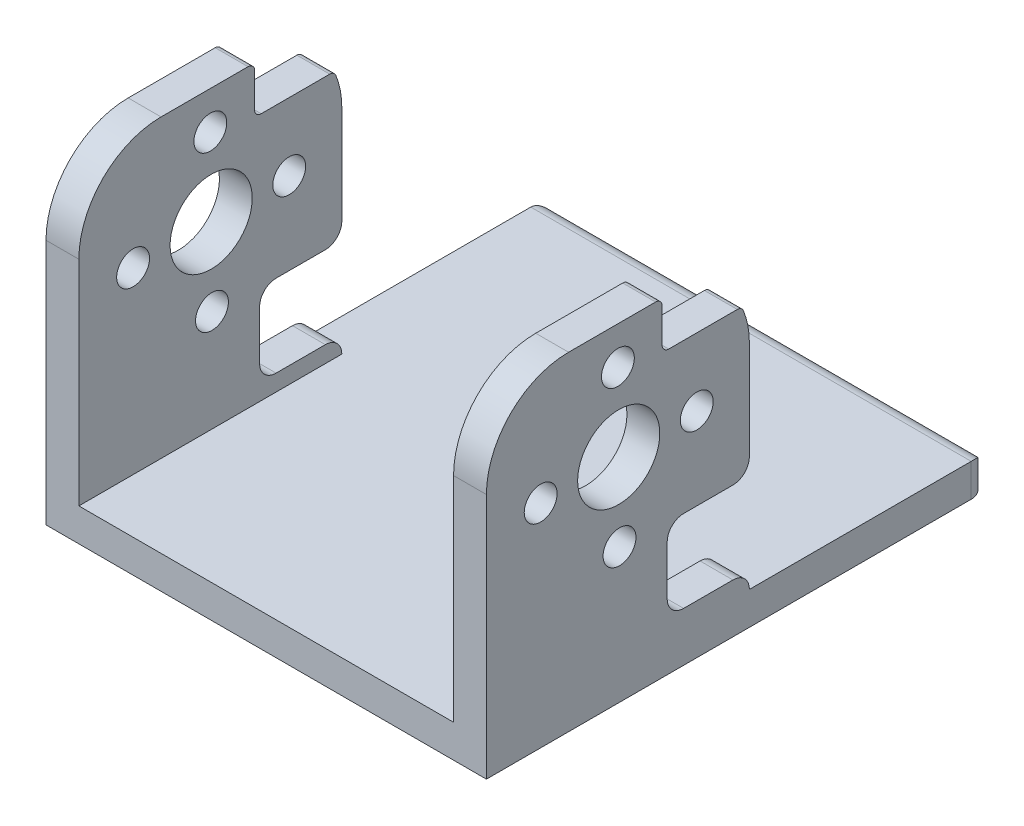
from build123d import *

# Parameters (mm, degrees)
SKETCH1_W           = 34.036
SKETCH1_H           = 20.32
BOSS_EXTRUDE1_DEPTH = 25.4
SKETCH2_W           = 28.956
SKETCH2_H           = 20.32
CUT_EXTRUDE1_DEPTH  = 22.86
SKETCH3_R           = 1.27
SKETCH3_R_2         = 3.175
CUT_EXTRUDE2_DEPTH  = 44.667320687
FILLET2_R           = 6.35
SKETCH8_W           = 6.35
SKETCH8_H           = 6.35
CUT_EXTRUDE5_DEPTH  = 44.667320687
FILLET4_R           = 1.27
SKETCH10_W          = 8.835648684
SKETCH10_H          = 6.964146722
CUT_EXTRUDE6_DEPTH  = 44.667320687
FILLET6_R           = 0.508
FILLET7_R           = 0.508
SKETCH11_W          = 34.036
SKETCH11_H          = 2.54
BOSS_EXTRUDE3_DEPTH = 18.415
FILLET8_R           = 1.27


with BuildPart() as part:
    # Sketch1 → Boss-Extrude1 (new body)
    with BuildSketch(Plane(origin=(0, 0, 0), x_dir=(1, 0, 0), z_dir=(0, 1, 0))):
        Rectangle(SKETCH1_W, SKETCH1_H)
    extrude(amount=BOSS_EXTRUDE1_DEPTH)

    # Sketch2 → Cut-Extrude1 (cut)
    with BuildSketch(Plane(origin=(0, 25.4, 0), x_dir=(1, 0, 0), z_dir=(0, 1, 0))):
        Rectangle(SKETCH2_W, SKETCH2_H)
    extrude(amount=-CUT_EXTRUDE1_DEPTH, mode=Mode.SUBTRACT)

    # Sketch3 → Cut-Extrude2 (cut, through all)
    with BuildSketch(Plane.ZY.offset(17.018)):
        with Locations((0, 22.479)):
            Circle(SKETCH3_R)
        with Locations((-6.096, 16.51)):
            Circle(SKETCH3_R)
        with Locations((-0.127, 10.414)):
            Circle(SKETCH3_R)
        with Locations((5.969, 16.383)):
            Circle(SKETCH3_R)
        with Locations((-0.0635, 16.4465)):
            Circle(SKETCH3_R_2)
    extrude(amount=-CUT_EXTRUDE2_DEPTH, mode=Mode.SUBTRACT)

    # Fillet2
    fillet2_edges = [part.edges().sort_by_distance(p)[0] for p in [
        (-15.748, 25.4, -10.16),
        (15.748, 25.4, 10.16),
        (-15.748, 25.4, 10.16),
        (15.748, 25.4, -10.16),
    ]]
    fillet(fillet2_edges, radius=FILLET2_R)

    # Sketch8 → Cut-Extrude5 (cut, through all)
    with BuildSketch(Plane(origin=(17.018, 0, 0), x_dir=(0, 0, -1), z_dir=(1, 0, 0))):
        with Locations((6.985, 6.985)):
            Rectangle(SKETCH8_W, SKETCH8_H)
    extrude(amount=-CUT_EXTRUDE5_DEPTH, mode=Mode.SUBTRACT)

    # Fillet4
    fillet4_edges = [part.edges().sort_by_distance(p)[0] for p in [
        (15.748, 10.16, -10.16),
        (-15.748, 10.16, -10.16),
        (15.748, 3.81, -10.16),
        (-15.748, 3.81, -10.16),
        (15.748, 3.81, -3.81),
        (-15.748, 3.81, -3.81),
        (15.748, 10.16, -3.81),
        (-15.748, 10.16, -3.81),
    ]]
    fillet(fillet4_edges, radius=FILLET4_R)

    # Sketch10 → Cut-Extrude6 (cut, through all)
    with BuildSketch(Plane(origin=(17.018, 0, 0), x_dir=(0, 0, -1), z_dir=(1, 0, 0))):
        with Locations((7.840277159, 25.226914104)):
            Rectangle(SKETCH10_W, SKETCH10_H)
    extrude(amount=-CUT_EXTRUDE6_DEPTH, mode=Mode.SUBTRACT)

    # Fillet6
    fillet6_edges = [part.edges().sort_by_distance(p)[0] for p in [
        (15.748, 25.4, -3.422452817),
        (15.748, 21.744840743, -3.422452817),
        (15.748, 21.744840743, -9.559811594),
    ]]
    fillet(fillet6_edges, radius=FILLET6_R)

    # Fillet7
    fillet7_edges = [part.edges().sort_by_distance(p)[0] for p in [
        (-15.748, 21.744840743, -9.559811594),
        (-15.748, 25.4, -3.422452817),
        (-15.748, 21.744840743, -3.422452817),
    ]]
    fillet(fillet7_edges, radius=FILLET7_R)

    # Sketch11 → Boss-Extrude3 (add)
    with BuildSketch(Plane(origin=(0, 0, -10.16), x_dir=(-1, 0, 0), z_dir=(0, 0, -1))):
        with Locations((0, 1.27)):
            Rectangle(SKETCH11_W, SKETCH11_H)
    extrude(amount=BOSS_EXTRUDE3_DEPTH)

    # Fillet8
    fillet8_edges = [part.edges().sort_by_distance(p)[0] for p in [
        (17.018, 1.27, -28.575),
        (-17.018, 1.27, -28.575),
        (0, 2.54, -28.575),
    ]]
    fillet(fillet8_edges, radius=FILLET8_R)


solid = part.part
